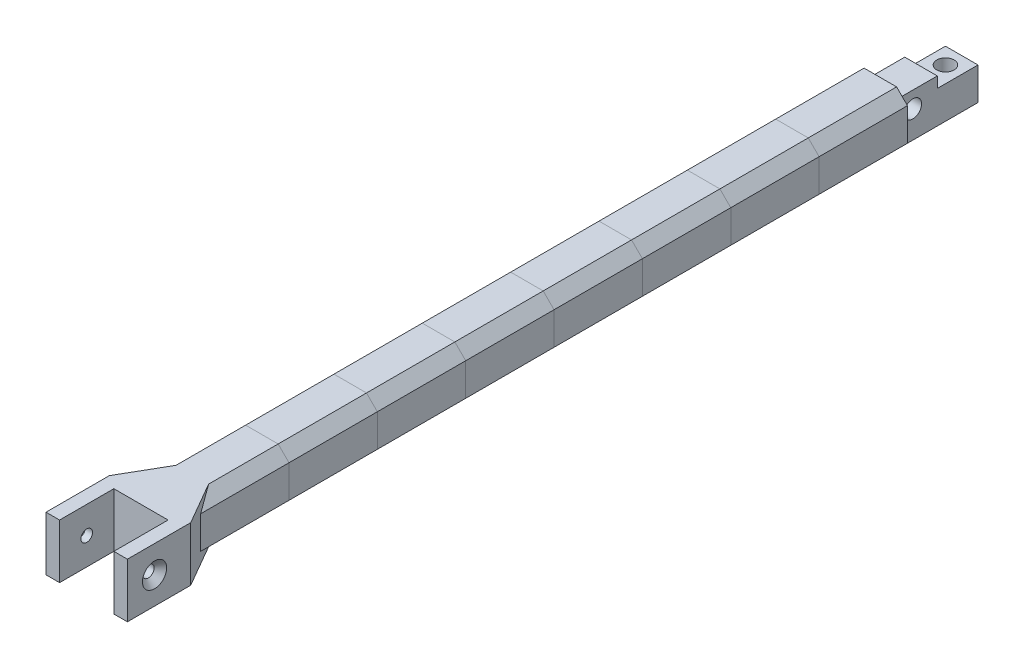
from build123d import *

# Parameters (mm, degrees)
SKETCH1_W             = 20
SKETCH1_H             = 20
BOSS_EXTRUDE1_DEPTH   = 302.5
BOSS_EXTRUDE2_DEPTH   = 20
SKETCH3_R             = 2.15
CUT_EXTRUDE1_DEPTH    = 325.046678736
SKETCH4_W             = 4
SKETCH4_H             = 30
CUT_EXTRUDE2_DEPTH    = 324.467540875
CHAMFER1_SIZE         = 2.3
SKETCH5_W             = 15
SKETCH5_H             = 8
CUT_EXTRUDE3_DEPTH    = 324.337671792
SKETCH6_R             = 3.2
CUT_EXTRUDE4_DEPTH    = 324.071586494
SKETCH7_R             = 3.2
CUT_EXTRUDE5_DEPTH    = 324.337671792
SKETCH10_W            = 20
SKETCH10_H            = 32.5625
CUT_EXTRUDE7_DEPTH    = 324.467540875
SKETCH11_W            = 20
SKETCH11_H            = 32.5625
BOSS_EXTRUDE3_DEPTH   = 20
BOSS_EXTRUDE3_2_DEPTH = 20
BOSS_EXTRUDE3_3_DEPTH = 20
BOSS_EXTRUDE3_4_DEPTH = 20
CHAMFER3_SIZE         = 4
CUT_EXTRUDE8_DEPTH    = 227.9375
SKETCH13_W            = 15
SKETCH13_H            = 4
CUT_EXTRUDE9_DEPTH    = 324.337671792


with BuildPart() as part:
    # Sketch1 → Boss-Extrude1 (new body)
    with BuildSketch(Plane.XY):
        Rectangle(SKETCH1_W, SKETCH1_H)
    extrude(amount=BOSS_EXTRUDE1_DEPTH)

    # Sketch2 → Boss-Extrude2 (add)
    with BuildSketch(Plane(origin=(0, 10, 0), x_dir=(1, 0, 0), z_dir=(0, 1, 0))):
        Polygon((10, -302.5), (10, -322.5), (15, -322.5), (15, -299.160254038), (10, -290.5), align=None)
        Polygon((-10, -290.5), (-10, -302.5), (-10, -322.5), (-15, -322.5), (-15, -299.160254038), align=None)
    extrude(amount=-BOSS_EXTRUDE2_DEPTH)

    # Sketch3 → Cut-Extrude1 (cut, through all)
    with BuildSketch(Plane(origin=(15, 0, 0), x_dir=(0, 0, -1), z_dir=(1, 0, 0))):
        with Locations((-312.5, 0)):
            Circle(SKETCH3_R)
    extrude(amount=-CUT_EXTRUDE1_DEPTH, mode=Mode.SUBTRACT)

    # Sketch4 → Cut-Extrude2 (cut, through all)
    with BuildSketch(Plane(origin=(0, 10, 0), x_dir=(1, 0, 0), z_dir=(0, 1, 0))):
        with Locations((-8, -15)):
            Rectangle(SKETCH4_W, SKETCH4_H)
        with Locations((8, -15)):
            Rectangle(SKETCH4_W, SKETCH4_H)
    extrude(amount=-CUT_EXTRUDE2_DEPTH, mode=Mode.SUBTRACT)

    # Chamfer1
    chamfer1_edges = [part.edges().sort_by_distance(p)[0] for p in [
        (-15, 0, 314.65),
        (15, 0, 314.65),
    ]]
    chamfer(chamfer1_edges, length=CHAMFER1_SIZE)

    # Sketch5 → Cut-Extrude3 (cut, through all)
    with BuildSketch(Plane(origin=(6, 0, 0), x_dir=(0, 0, -1), z_dir=(1, 0, 0))):
        with Locations((-7.5, 6)):
            Rectangle(SKETCH5_W, SKETCH5_H)
    extrude(amount=-CUT_EXTRUDE3_DEPTH, mode=Mode.SUBTRACT)

    # Sketch6 → Cut-Extrude4 (cut, through all)
    with BuildSketch(Plane(origin=(0, 2, 0), x_dir=(1, 0, 0), z_dir=(0, 1, 0))):
        with Locations(Location((0, -6, 0), (0, 0, 270))):
            Circle(SKETCH6_R)
    extrude(amount=-CUT_EXTRUDE4_DEPTH, mode=Mode.SUBTRACT)

    # Sketch7 → Cut-Extrude5 (cut, through all)
    with BuildSketch(Plane(origin=(6, 0, 0), x_dir=(0, 0, -1), z_dir=(1, 0, 0))):
        with Locations((-24, 0)):
            Circle(SKETCH7_R)
    extrude(amount=-CUT_EXTRUDE5_DEPTH, mode=Mode.SUBTRACT)

    # Sketch10 → Cut-Extrude7 (cut, through all)
    with BuildSketch(Plane(origin=(0, 10, 0), x_dir=(1, 0, 0), z_dir=(0, 1, 0))):
        with Locations((0, -46.28125)):
            Rectangle(SKETCH10_W, SKETCH10_H)
        with Locations((0, -111.40625)):
            Rectangle(SKETCH10_W, SKETCH10_H)
        with Locations((0, -176.53125)):
            Rectangle(SKETCH10_W, SKETCH10_H)
        with Locations((0, -241.65625)):
            Rectangle(SKETCH10_W, SKETCH10_H)
    extrude(amount=-CUT_EXTRUDE7_DEPTH, mode=Mode.SUBTRACT)


with BuildPart() as cut_extrude7_piece_1:
    # of the separate pieces the step leaves, piece 1, a body of its own (cut_extrude7_pieces)
    add(part.part.solids().sort_by_distance((15, 0, 308.05))[0])

    # Chamfer3
    chamfer3_edges = [cut_extrude7_piece_1.edges().sort_by_distance(p)[0] for p in [
        (10, 10, 274.21875),
        (-10, 10, 274.21875),
        (-10, -10, 274.21875),
        (10, -10, 274.21875),
    ]]
    chamfer(chamfer3_edges, length=CHAMFER3_SIZE)


with BuildPart() as cut_extrude7_piece_2:
    # of the separate pieces the step leaves, piece 2, a body of its own (cut_extrude7_pieces)
    add(part.part.solids().sort_by_distance((10, 10, 192.8125))[0])


with BuildPart() as cut_extrude7_piece_3:
    # of the separate pieces the step leaves, piece 3, a body of its own (cut_extrude7_pieces)
    add(part.part.solids().sort_by_distance((10, 10, 62.5625))[0])


with BuildPart() as cut_extrude7_piece_4:
    # of the separate pieces the step leaves, piece 4, a body of its own (cut_extrude7_pieces)
    add(part.part.solids().sort_by_distance((-10, 10, 127.6875))[0])


with BuildPart() as cut_extrude7_piece_5:
    # of the separate pieces the step leaves, piece 5, a body of its own (cut_extrude7_pieces)
    add(part.part.solids().sort_by_distance((6, 10, 15))[0])

    # Sketch13 → Cut-Extrude9 (cut, through all)
    with BuildSketch(Plane(origin=(6, 0, 0), x_dir=(0, 0, -1), z_dir=(1, 0, 0))):
        with Locations((-22.5, 8)):
            Rectangle(SKETCH13_W, SKETCH13_H)
    extrude(amount=-CUT_EXTRUDE9_DEPTH, mode=Mode.SUBTRACT)


with BuildPart() as body_6:
    # Sketch11 → Boss-Extrude3 (new body)
    with BuildSketch(Plane(origin=(0, 10, 0), x_dir=(1, 0, 0), z_dir=(0, 1, 0))):
        with Locations((0, -46.28125)):
            Rectangle(SKETCH11_W, SKETCH11_H)
    extrude(amount=-BOSS_EXTRUDE3_DEPTH)


with BuildPart() as body_7:
    # Sketch11 → Boss-Extrude3 2 (new body)
    with BuildSketch(Plane(origin=(0, 10, 0), x_dir=(1, 0, 0), z_dir=(0, 1, 0))):
        with Locations((0, -111.40625)):
            Rectangle(SKETCH11_W, SKETCH11_H)
    extrude(amount=-BOSS_EXTRUDE3_2_DEPTH)


with BuildPart() as body_8:
    # Sketch11 → Boss-Extrude3 3 (new body)
    with BuildSketch(Plane(origin=(0, 10, 0), x_dir=(1, 0, 0), z_dir=(0, 1, 0))):
        with Locations((0, -176.53125)):
            Rectangle(SKETCH11_W, SKETCH11_H)
    extrude(amount=-BOSS_EXTRUDE3_3_DEPTH)


with BuildPart() as body_9:
    # Sketch11 → Boss-Extrude3 4 (new body)
    with BuildSketch(Plane(origin=(0, 10, 0), x_dir=(1, 0, 0), z_dir=(0, 1, 0))):
        with Locations((0, -241.65625)):
            Rectangle(SKETCH11_W, SKETCH11_H)
    extrude(amount=-BOSS_EXTRUDE3_4_DEPTH)


with BuildPart() as cut_extrude8_tool:
    # Sketch12 → Cut-Extrude8 (new body)
    with BuildSketch(Plane(origin=(0, 0, 30), x_dir=(-1, 0, 0), z_dir=(0, 0, -1))):
        Polygon((-10, 10), (-6, 10), (-10, 6), align=None)
        Polygon((-10, -10), (-10, -6), (-6, -10), align=None)
        Polygon((6, 10), (10, 10), (10, 6), align=None)
        Polygon((10, -10), (10, -6), (6, -10), align=None)
    extrude(amount=-CUT_EXTRUDE8_DEPTH)


with BuildPart() as cut_extrude7_piece_2_1:
    add(cut_extrude7_piece_2.part)

    # Cut-Extrude8: cut by cut_extrude8_tool
    add(cut_extrude8_tool.part, mode=Mode.SUBTRACT)


with BuildPart() as cut_extrude7_piece_3_1:
    add(cut_extrude7_piece_3.part)

    # Cut-Extrude8: cut by cut_extrude8_tool
    add(cut_extrude8_tool.part, mode=Mode.SUBTRACT)


with BuildPart() as cut_extrude7_piece_4_1:
    add(cut_extrude7_piece_4.part)

    # Cut-Extrude8: cut by cut_extrude8_tool
    add(cut_extrude8_tool.part, mode=Mode.SUBTRACT)


with BuildPart() as body_6_1:
    add(body_6.part)

    # Cut-Extrude8: cut by cut_extrude8_tool
    add(cut_extrude8_tool.part, mode=Mode.SUBTRACT)


with BuildPart() as body_7_1:
    add(body_7.part)

    # Cut-Extrude8: cut by cut_extrude8_tool
    add(cut_extrude8_tool.part, mode=Mode.SUBTRACT)


with BuildPart() as body_8_1:
    add(body_8.part)

    # Cut-Extrude8: cut by cut_extrude8_tool
    add(cut_extrude8_tool.part, mode=Mode.SUBTRACT)


with BuildPart() as body_9_1:
    add(body_9.part)

    # Cut-Extrude8: cut by cut_extrude8_tool
    add(cut_extrude8_tool.part, mode=Mode.SUBTRACT)


solid = Compound([cut_extrude7_piece_1.part, cut_extrude7_piece_5.part, cut_extrude7_piece_2_1.part, cut_extrude7_piece_3_1.part, cut_extrude7_piece_4_1.part, body_6_1.part, body_7_1.part, body_8_1.part, body_9_1.part])
